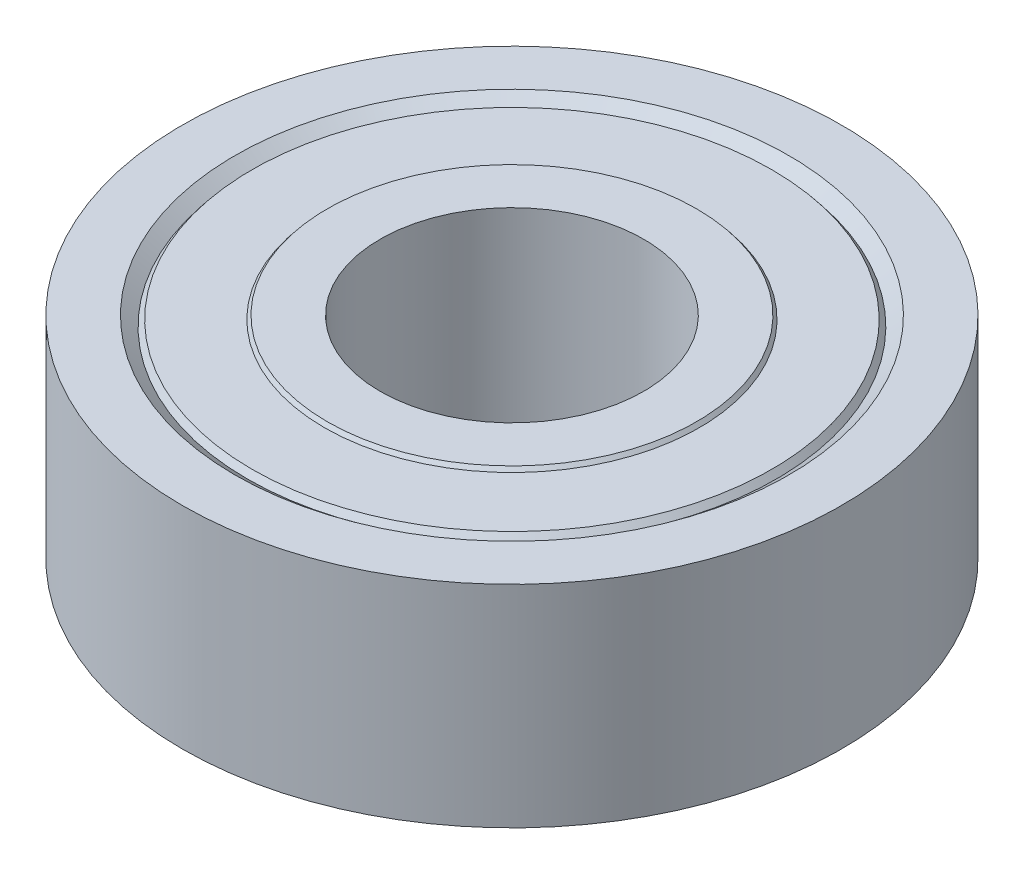
from build123d import *


with BuildPart() as part:
    # Sketch2 → Revolve1 (revolve)
    with BuildSketch(Plane.XY, mode=Mode.PRIVATE) as revolve1_sk:
        Polygon((3.175, 2.54), (3.175, 0), (4.445, 0), (4.515219321, 0.08811431), (6.255009696, 0.08811431), (6.367985801, 0.23321048), (6.6675, 0), (7.9375, 0), (7.9375, 5.08), (6.6675, 5.08), (6.367985801, 4.84678952), (6.255009696, 4.99188569), (4.515219321, 4.99188569), (4.445, 5.08), (3.175, 5.08), align=None)
    revolve(revolve1_sk.sketch.rotate(Axis((0, 5.08, 0), (0, -1, 0)), 90), axis=Axis((0, 5.08, 0), (0, -1, 0)))


solid = part.part
